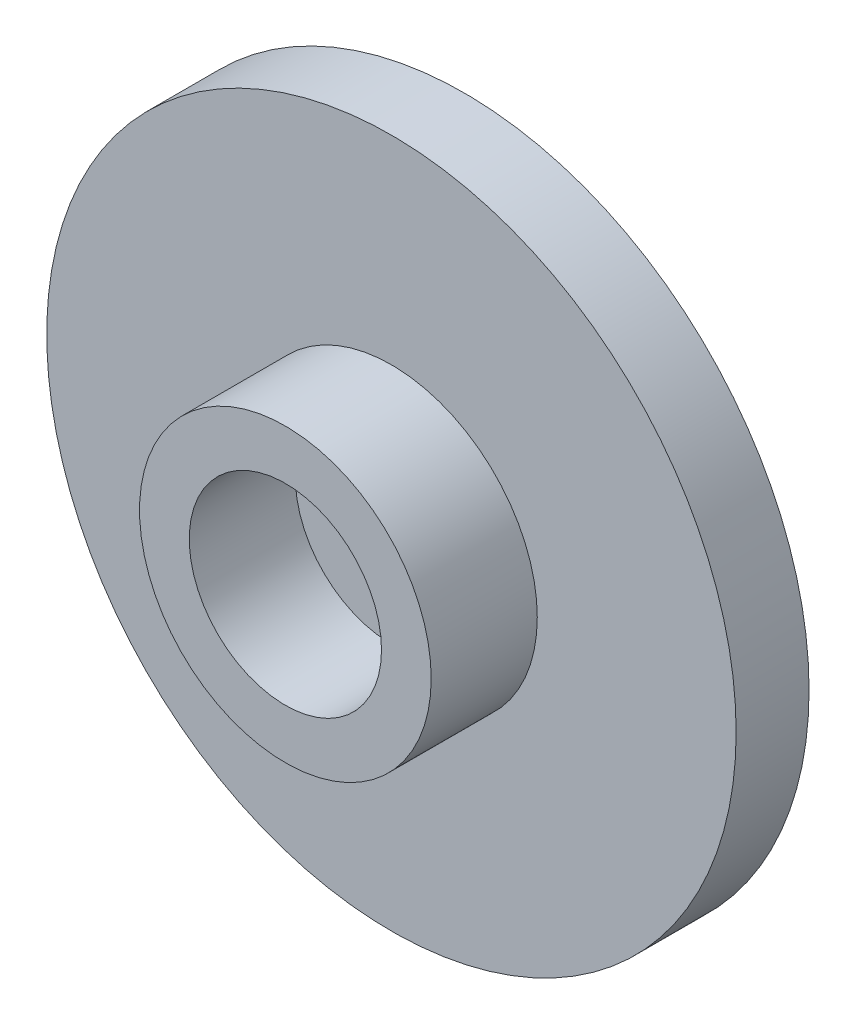
from build123d import *

# Parameters (mm, degrees)
SKETCH1_R           = 10.4
BOSS_EXTRUDE1_DEPTH = 2.2
SKETCH2_R           = 4.4
SKETCH2_R_2         = 2.9
BOSS_EXTRUDE2_DEPTH = 3.2


with BuildPart() as part:
    # Sketch1 → Boss-Extrude1 (new body)
    with BuildSketch(Plane.XY):
        Circle(SKETCH1_R)
    extrude(amount=BOSS_EXTRUDE1_DEPTH)

    # Sketch2 → Boss-Extrude2 (add)
    with BuildSketch(Plane.XY.offset(2.2)):
        Circle(SKETCH2_R)
        Circle(SKETCH2_R_2, mode=Mode.SUBTRACT)
    extrude(amount=BOSS_EXTRUDE2_DEPTH)


solid = part.part
